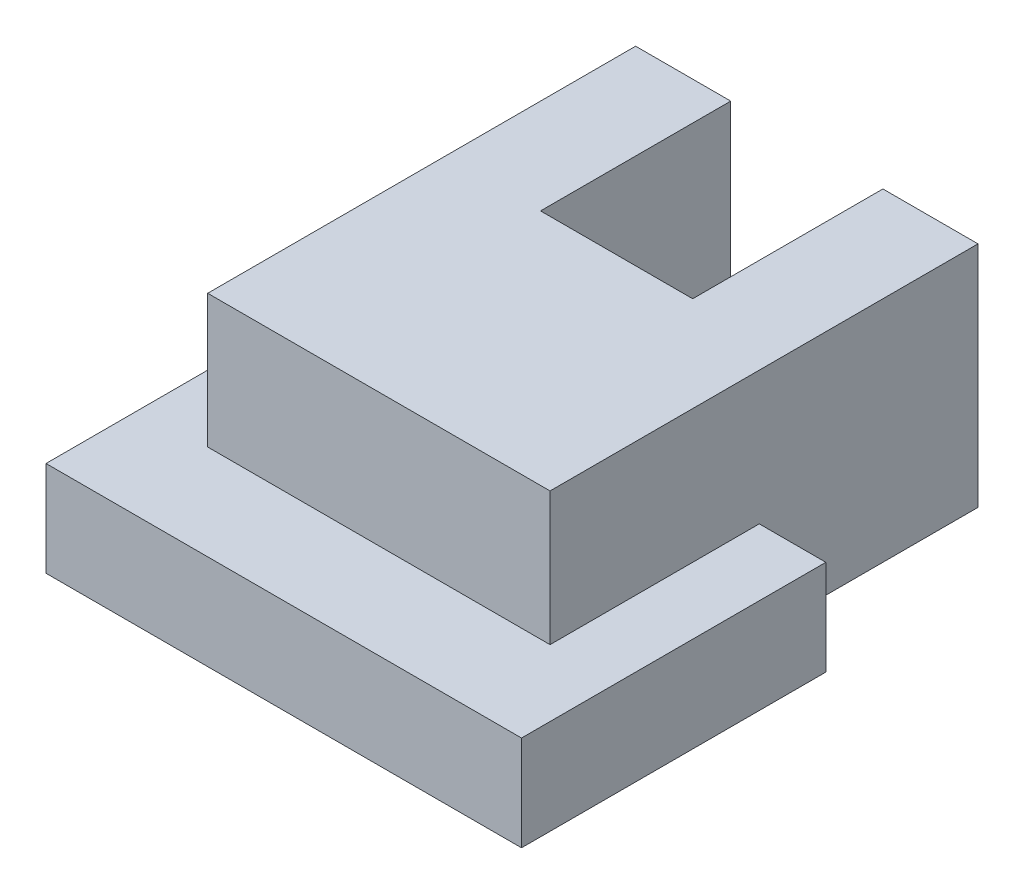
from build123d import *

# Parameters (mm, degrees)
CROQUIS1_W                          = 50
CROQUIS1_H                          = 32
SALIENTE_EXTRUIR1_DEPTH             = 10
SALIENTE_EXTRUIR4_DEPTH             = 14
SALIENTE_EXTRUIR4_DIRECTION_2_REACH = 33.321


with BuildPart() as part:
    # Croquis1 → Saliente-Extruir1 (new body)
    with BuildSketch(Plane(origin=(0, 0, 0), x_dir=(1, 0, 0), z_dir=(0, 1, 0))):
        Rectangle(CROQUIS1_W, CROQUIS1_H)
    extrude(amount=SALIENTE_EXTRUIR1_DEPTH)

    # Croquis2 → Saliente-Extruir4 (add)
    with BuildSketch(Plane(origin=(0, 10, 0), x_dir=(1, 0, 0), z_dir=(0, 1, 0))):
        Polygon((-8, 39), (-18, 39), (-18, -6), (18, -6), (18, 39), (8, 39), (8, 19), (-8, 19), align=None)
    extrude(amount=SALIENTE_EXTRUIR4_DEPTH)

    # Saliente-Extruir4 direction 2: up to this face of the body (flat: up to its plane)
    saliente_extruir4_direction_2_end = Plane(part.part.faces().sort_by_distance((0, 0, 0))[0])
    # Croquis2 → Saliente-Extruir4 direction 2 (add, up to the picked face)
    with BuildSketch(Plane(origin=(0, 10, 0), x_dir=(1, 0, 0), z_dir=(0, 1, 0)), mode=Mode.PRIVATE) as saliente_extruir4_direction_2_sk1:
        Polygon((-8, 39), (-18, 39), (-18, -6), (18, -6), (18, 39), (8, 39), (8, 19), (-8, 19), align=None)
    saliente_extruir4_direction_2_tool1 = split(extrude(saliente_extruir4_direction_2_sk1.sketch, amount=-SALIENTE_EXTRUIR4_DIRECTION_2_REACH, mode=Mode.PRIVATE), bisect_by=saliente_extruir4_direction_2_end, keep=Keep.BOTH, mode=Mode.PRIVATE)
    add(saliente_extruir4_direction_2_tool1.solids().sort_by(Axis((0, 10, -13.423077), (0, -1, 0)))[0])


solid = part.part
